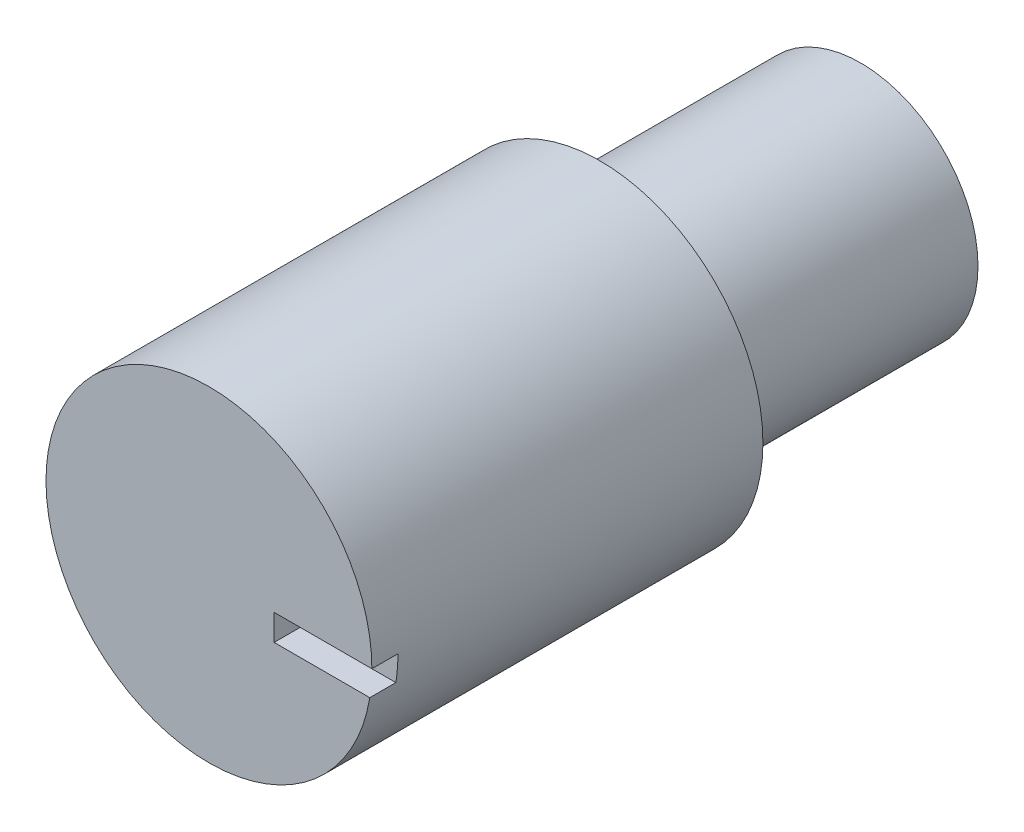
from build123d import *

# Parameters (mm, degrees)
SKETCH_1_R          = 25
EXTRUDE_1_DEPTH     = 60
SKETCH_2_R          = 18
EXTRUDE_2_DEPTH     = 100
SKETCH_3_W          = 25
SKETCH_3_H          = 8
CUT_EXTRUDE_1_DEPTH = 4


with BuildPart() as part:
    # 草图1 → 凸台-拉伸1 (new body)
    with BuildSketch(Plane.XY):
        Circle(SKETCH_1_R)
    extrude(amount=-EXTRUDE_1_DEPTH)

    # 草图2 → 凸台-拉伸2 (add)
    with BuildSketch(Plane.XY):
        Circle(SKETCH_2_R)
    extrude(amount=-EXTRUDE_2_DEPTH)

    # 草图3 → 切除-拉伸1 (cut)
    with BuildSketch(Plane(origin=(0, 0, 0), x_dir=(1, 0, 0), z_dir=(0, 1, 0))):
        with Locations((22.5, 0)):
            Rectangle(SKETCH_3_W, SKETCH_3_H)
    extrude(amount=-CUT_EXTRUDE_1_DEPTH, mode=Mode.SUBTRACT)


solid = part.part
